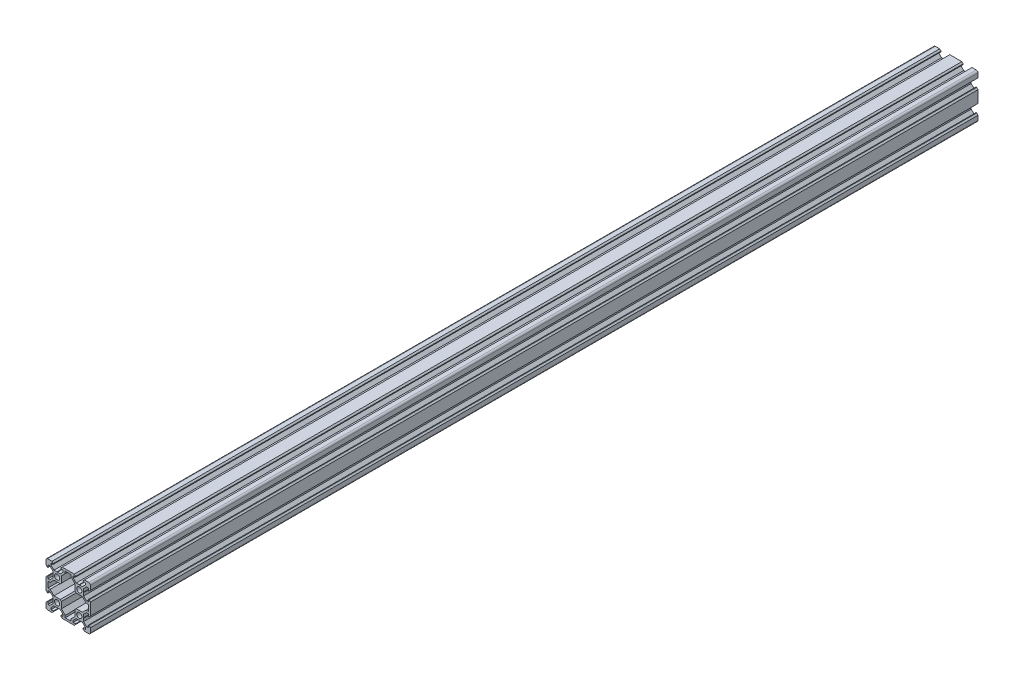
from build123d import *

# Parameters (mm, degrees)
SKETCH1_R           = 2.3
BOSS_EXTRUDE1_DEPTH = 800


with BuildPart() as part:
    # Sketch1 → Boss-Extrude1 (new body)
    with BuildSketch(Plane.XY):
        with BuildLine():
            Line((14.58, -20), (18.5, -20))
            ThreePointArc((18.5, -20), (19.560660172, -19.560660172), (20, -18.5))
            Line((20, -18.5), (20, -14.58))
            Line((20, -14.58), (18.815, -13.395))
            Line((18.815, -13.395), (18.2, -13.395))
            Line((18.2, -13.395), (18.2, -15.5))
            Line((18.2, -15.5), (16.560660172, -15.5))
            Line((16.560660172, -15.5), (13.9, -12.839339828))
            Line((13.9, -12.839339828), (13.9, -10.21))
            Line((13.9, -10.21), (13.69, -10))
            Line((13.69, -10), (13.9, -9.79))
            Line((13.9, -9.79), (13.9, -7.160660172))
            Line((13.9, -7.160660172), (16.560660172, -4.5))
            Line((16.560660172, -4.5), (18.2, -4.5))
            Line((18.2, -4.5), (18.2, -6.605))
            Line((18.2, -6.605), (18.815, -6.605))
            Line((18.815, -6.605), (20, -5.42))
            Line((20, -5.42), (20, 5.42))
            Line((20, 5.42), (18.815, 6.605))
            Line((18.815, 6.605), (18.2, 6.605))
            Line((18.2, 6.605), (18.2, 4.5))
            Line((18.2, 4.5), (16.560660172, 4.5))
            Line((16.560660172, 4.5), (13.9, 7.160660172))
            Line((13.9, 7.160660172), (13.9, 9.79))
            Line((13.9, 9.79), (13.69, 10))
            Line((13.69, 10), (13.9, 10.21))
            Line((13.9, 10.21), (13.9, 12.839339828))
            Line((13.9, 12.839339828), (16.560660172, 15.5))
            Line((16.560660172, 15.5), (18.2, 15.5))
            Line((18.2, 15.5), (18.2, 13.395))
            Line((18.2, 13.395), (18.815, 13.395))
            Line((18.815, 13.395), (20, 14.58))
            Line((20, 14.58), (20, 18.5))
            ThreePointArc((20, 18.5), (19.560660172, 19.560660172), (18.5, 20))
            Line((18.5, 20), (14.58, 20))
            Line((14.58, 20), (13.395, 18.815))
            Line((13.395, 18.815), (13.395, 18.2))
            Line((13.395, 18.2), (15.5, 18.2))
            Line((15.5, 18.2), (15.5, 16.560660172))
            Line((15.5, 16.560660172), (12.839339828, 13.9))
            Line((12.839339828, 13.9), (10.21, 13.9))
            Line((10.21, 13.9), (10, 13.69))
            Line((10, 13.69), (9.79, 13.9))
            Line((9.79, 13.9), (7.160660172, 13.9))
            Line((7.160660172, 13.9), (4.5, 16.560660172))
            Line((4.5, 16.560660172), (4.5, 18.2))
            Line((4.5, 18.2), (6.605, 18.2))
            Line((6.605, 18.2), (6.605, 18.815))
            Line((6.605, 18.815), (5.42, 20))
            Line((5.42, 20), (-5.42, 20))
            Line((-5.42, 20), (-6.605, 18.815))
            Line((-6.605, 18.815), (-6.605, 18.2))
            Line((-6.605, 18.2), (-4.5, 18.2))
            Line((-4.5, 18.2), (-4.5, 16.560660172))
            Line((-4.5, 16.560660172), (-7.160660172, 13.9))
            Line((-7.160660172, 13.9), (-9.79, 13.9))
            Line((-9.79, 13.9), (-10, 13.69))
            Line((-10, 13.69), (-10.21, 13.9))
            Line((-10.21, 13.9), (-12.839339828, 13.9))
            Line((-12.839339828, 13.9), (-15.5, 16.560660172))
            Line((-15.5, 16.560660172), (-15.5, 18.2))
            Line((-15.5, 18.2), (-13.395, 18.2))
            Line((-13.395, 18.2), (-13.395, 18.815))
            Line((-13.395, 18.815), (-14.58, 20))
            Line((-14.58, 20), (-18.5, 20))
            ThreePointArc((-18.5, 20), (-19.560660172, 19.560660172), (-20, 18.5))
            Line((-20, 18.5), (-20, 14.58))
            Line((-20, 14.58), (-18.815, 13.395))
            Line((-18.815, 13.395), (-18.2, 13.395))
            Line((-18.2, 13.395), (-18.2, 15.5))
            Line((-18.2, 15.5), (-16.560660172, 15.5))
            Line((-16.560660172, 15.5), (-13.9, 12.839339828))
            Line((-13.9, 12.839339828), (-13.9, 10.21))
            Line((-13.9, 10.21), (-13.69, 10))
            Line((-13.69, 10), (-13.9, 9.79))
            Line((-13.9, 9.79), (-13.9, 7.160660172))
            Line((-13.9, 7.160660172), (-16.560660172, 4.5))
            Line((-16.560660172, 4.5), (-18.2, 4.5))
            Line((-18.2, 4.5), (-18.2, 6.605))
            Line((-18.2, 6.605), (-18.815, 6.605))
            Line((-18.815, 6.605), (-20, 5.42))
            Line((-20, 5.42), (-20, -5.42))
            Line((-20, -5.42), (-18.815, -6.605))
            Line((-18.815, -6.605), (-18.2, -6.605))
            Line((-18.2, -6.605), (-18.2, -4.5))
            Line((-18.2, -4.5), (-16.560660172, -4.5))
            Line((-16.560660172, -4.5), (-13.9, -7.160660172))
            Line((-13.9, -7.160660172), (-13.9, -9.79))
            Line((-13.9, -9.79), (-13.69, -10))
            Line((-13.69, -10), (-13.9, -10.21))
            Line((-13.9, -10.21), (-13.9, -12.839339828))
            Line((-13.9, -12.839339828), (-16.560660172, -15.5))
            Line((-16.560660172, -15.5), (-18.2, -15.5))
            Line((-18.2, -15.5), (-18.2, -13.395))
            Line((-18.2, -13.395), (-18.815, -13.395))
            Line((-18.815, -13.395), (-20, -14.58))
            Line((-20, -14.58), (-20, -18.5))
            ThreePointArc((-20, -18.5), (-19.560660172, -19.560660172), (-18.5, -20))
            Line((-18.5, -20), (-14.58, -20))
            Line((-14.58, -20), (-13.395, -18.815))
            Line((-13.395, -18.815), (-13.395, -18.2))
            Line((-13.395, -18.2), (-15.5, -18.2))
            Line((-15.5, -18.2), (-15.5, -16.560660172))
            Line((-15.5, -16.560660172), (-12.839339828, -13.9))
            Line((-12.839339828, -13.9), (-10.21, -13.9))
            Line((-10.21, -13.9), (-10, -13.69))
            Line((-10, -13.69), (-9.79, -13.9))
            Line((-9.79, -13.9), (-7.160660172, -13.9))
            Line((-7.160660172, -13.9), (-4.5, -16.560660172))
            Line((-4.5, -16.560660172), (-4.5, -18.2))
            Line((-4.5, -18.2), (-6.605, -18.2))
            Line((-6.605, -18.2), (-6.605, -18.815))
            Line((-6.605, -18.815), (-5.42, -20))
            Line((-5.42, -20), (5.42, -20))
            Line((5.42, -20), (6.605, -18.815))
            Line((6.605, -18.815), (6.605, -18.2))
            Line((6.605, -18.2), (4.5, -18.2))
            Line((4.5, -18.2), (4.5, -16.560660172))
            Line((4.5, -16.560660172), (7.160660172, -13.9))
            Line((7.160660172, -13.9), (9.79, -13.9))
            Line((9.79, -13.9), (10, -13.69))
            Line((10, -13.69), (10.21, -13.9))
            Line((10.21, -13.9), (12.839339828, -13.9))
            Line((12.839339828, -13.9), (15.5, -16.560660172))
            Line((15.5, -16.560660172), (15.5, -18.2))
            Line((15.5, -18.2), (13.395, -18.2))
            Line((13.395, -18.2), (13.395, -18.815))
            Line((13.395, -18.815), (14.58, -20))
        make_face()
        with Locations((-10, -10)):
            Circle(SKETCH1_R, mode=Mode.SUBTRACT)
        with Locations((10, -10)):
            Circle(SKETCH1_R, mode=Mode.SUBTRACT)
        Polygon((-16.239339828, -2.7), (-18.2, -2.7), (-18.2, 2.7), (-16.239339828, 2.7), (-12.839339828, 6.1), (-7.160660172, 6.1), (-6.1, 7.160660172), (-6.1, 12.839339828), (-2.7, 16.239339828), (-2.7, 18.2), (2.7, 18.2), (2.7, 16.239339828), (6.1, 12.839339828), (6.1, 7.160660172), (7.160660172, 6.1), (12.839339828, 6.1), (16.239339828, 2.7), (18.2, 2.7), (18.2, -2.7), (16.239339828, -2.7), (12.839339828, -6.1), (7.160660172, -6.1), (6.1, -7.160660172), (6.1, -12.839339828), (2.7, -16.239339828), (2.7, -18.2), (-2.7, -18.2), (-2.7, -16.239339828), (-6.1, -12.839339828), (-6.1, -7.160660172), (-7.160660172, -6.1), (-12.839339828, -6.1), align=None, mode=Mode.SUBTRACT)
        with Locations((-10, 10)):
            Circle(SKETCH1_R, mode=Mode.SUBTRACT)
        with Locations((10, 10)):
            Circle(SKETCH1_R, mode=Mode.SUBTRACT)
    extrude(amount=BOSS_EXTRUDE1_DEPTH)


solid = part.part
